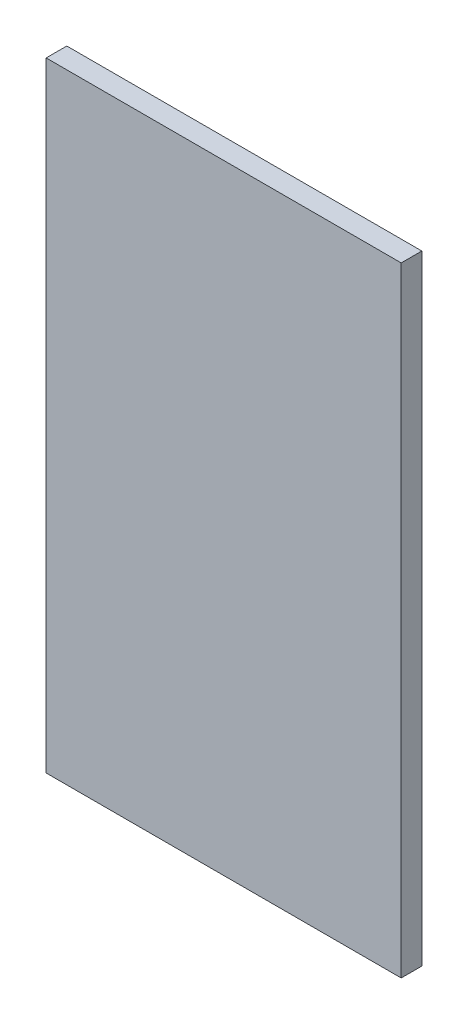
from build123d import *

# Parameters (mm, degrees)
SKETCH_2_W      = 172
SKETCH_2_H      = 300
EXTRUDE_1_DEPTH = 10


with BuildPart() as part:
    # Эскиз2 → Бобышка-Вытянуть1 (new body)
    with BuildSketch(Plane.XY):
        with Locations((86, 150)):
            Rectangle(SKETCH_2_W, SKETCH_2_H)
    extrude(amount=EXTRUDE_1_DEPTH)


solid = part.part
